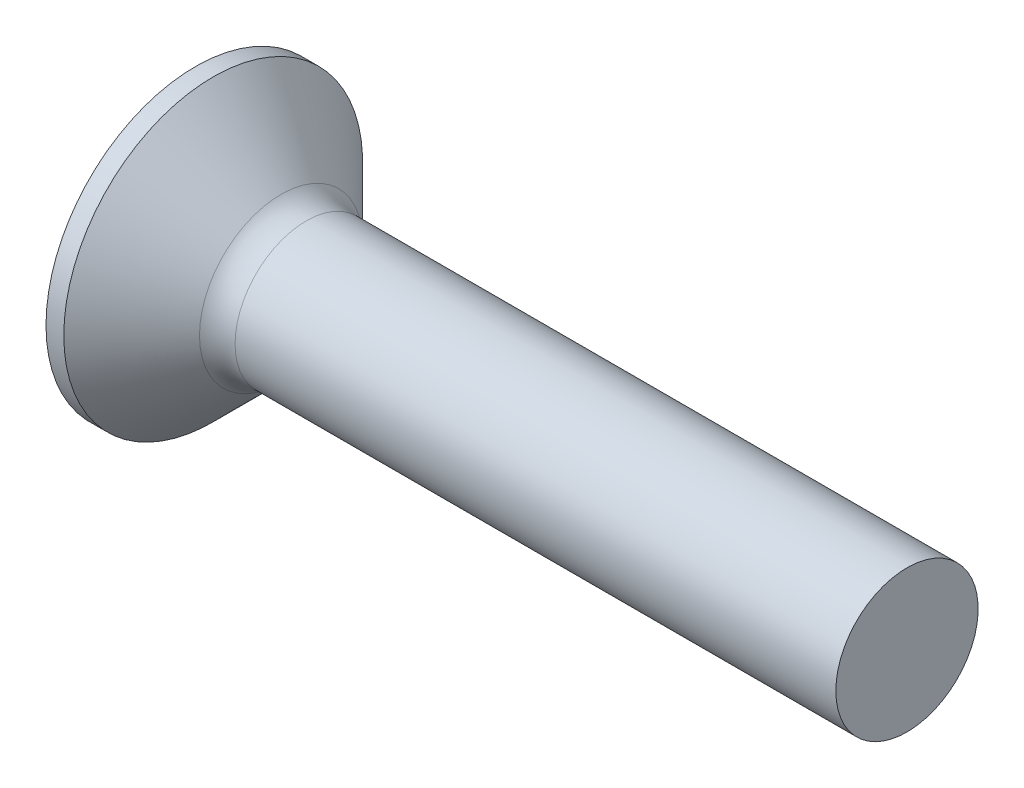
from build123d import *

# Parameters (mm, degrees)
FILLET1_R    = 1
RECPAT_COUNT = 2
RECPAT_ANGLE = 90


with BuildPart() as part:
    # BodySke → Base-Revolve (revolve)
    with BuildSketch(Plane.XY, mode=Mode.PRIVATE) as base_revolve_sk:
        Polygon((0, 0), (0, 4.2), (0.5, 4.2), (2.7, 2), (20, 2), (20, 0), align=None)
    revolve(base_revolve_sk.sketch.rotate(Axis((-6.35, 0, 0), (1, 0, 0)), 90), axis=Axis((-6.35, 0, 0), (1, 0, 0)))

    # Fillet1
    fillet1_edges = [part.edges().sort_by_distance(p)[0] for p in [
        (2.7, 0, -2),
    ]]
    fillet(fillet1_edges, radius=FILLET1_R)

    # Sketch3 → Recess section 0
    with BuildSketch(Plane.ZY):
        with BuildLine():
            Line((-0.515, 2.2), (0.515, 2.2))
            Line((0.515, 2.2), (0.515, -2.2))
            Line((0.515, -2.2), (-0.515, -2.2))
            Line((-0.515, -2.2), (-0.515, 2.2))
        make_face()
    # Sketch4 → Recess section 1
    with BuildSketch(Plane.ZY.offset(-2.51)):
        with BuildLine():
            Line((-0.515, 0.948560373), (0.515, 0.948560373))
            Line((0.515, 0.948560373), (0.515, -0.948560373))
            Line((0.515, -0.948560373), (-0.515, -0.948560373))
            Line((-0.515, -0.948560373), (-0.515, 0.948560373))
        make_face()
    recess = loft(mode=Mode.SUBTRACT)

    # RecPat: Recess ×2 about axis
    recpat_axis = Axis((0, 0, 0), (1, 0, 0))
    for i in range(1, RECPAT_COUNT):
        add(recess.rotate(recpat_axis, i * RECPAT_ANGLE / (RECPAT_COUNT - 1)), mode=Mode.SUBTRACT)

    # RecCorSke → RecessCore (revolve, cut)
    with BuildSketch(Plane.XY, mode=Mode.PRIVATE) as recesscore_sk:
        Polygon((0, 0), (0, 1.026516298), (2.51, 0.851), (2.786506661, 0), align=None)
    revolve(recesscore_sk.sketch.rotate(Axis((-3.175, 0, 0), (1, 0, 0)), 90), axis=Axis((-3.175, 0, 0), (1, 0, 0)), mode=Mode.SUBTRACT)


solid = part.part
